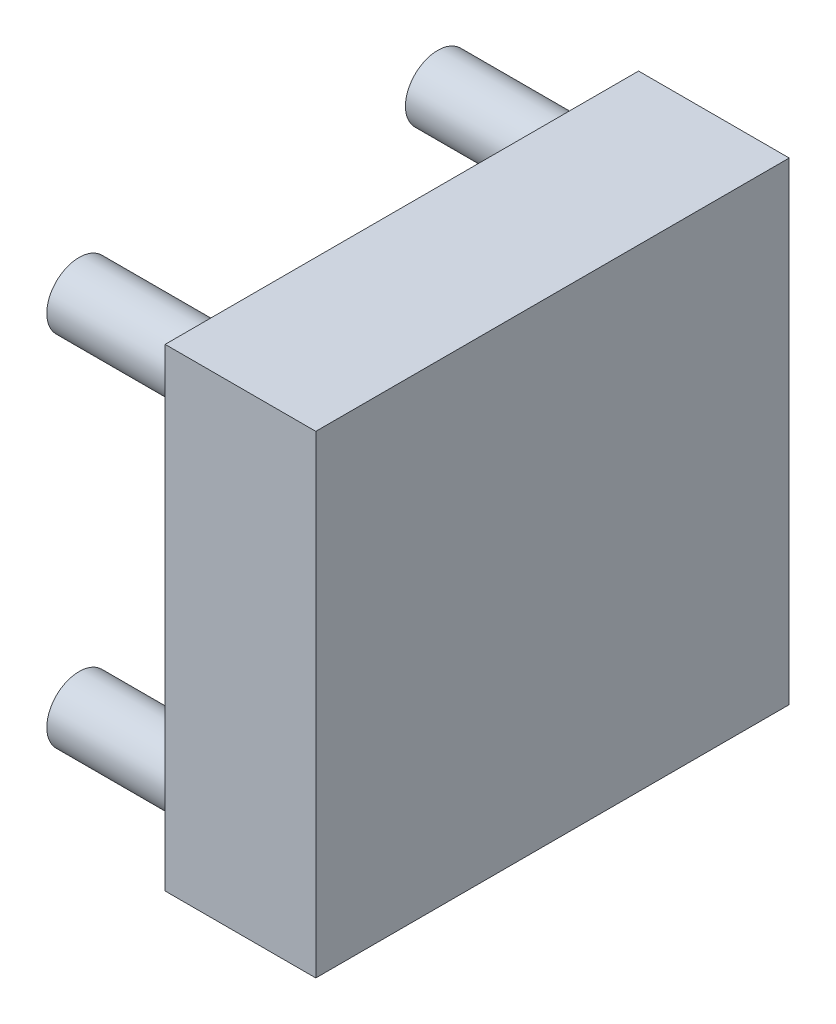
from build123d import *

# Parameters (mm, degrees)
SKETCH1_W           = 33
SKETCH1_H           = 33
BOSS_EXTRUDE1_DEPTH = 10.5
SKETCH2_R           = 2.25
SKETCH2_R_2         = 1.5
BOSS_EXTRUDE2_DEPTH = 10


with BuildPart() as part:
    # Sketch1 → Boss-Extrude1 (new body)
    with BuildSketch(Plane(origin=(0, 0, 0), x_dir=(0, 0, -1), z_dir=(1, 0, 0))):
        Rectangle(SKETCH1_W, SKETCH1_H)
    extrude(amount=BOSS_EXTRUDE1_DEPTH)

    # Sketch2 → Boss-Extrude2 (add)
    # profile 1 of 4: a face of its own
    with BuildSketch(Plane.ZY):
        with Locations((-12.5, 12.5)):
            Circle(SKETCH2_R)
        with Locations((-12.5, 12.5)):
            Circle(SKETCH2_R_2, mode=Mode.SUBTRACT)
    # profile 2 of 4: a face of its own
    with BuildSketch(Plane.ZY):
        with Locations((-12.5, -12.5)):
            Circle(SKETCH2_R)
        with Locations((-12.5, -12.5)):
            Circle(SKETCH2_R_2, mode=Mode.SUBTRACT)
    # profile 3 of 4: a face of its own
    with BuildSketch(Plane.ZY):
        with Locations((12.5, -12.5)):
            Circle(SKETCH2_R)
        with Locations((12.5, -12.5)):
            Circle(SKETCH2_R_2, mode=Mode.SUBTRACT)
    # profile 4 of 4: a face of its own
    with BuildSketch(Plane.ZY):
        with Locations((12.5, 12.5)):
            Circle(SKETCH2_R)
        with Locations((12.5, 12.5)):
            Circle(SKETCH2_R_2, mode=Mode.SUBTRACT)
    extrude(amount=BOSS_EXTRUDE2_DEPTH)


solid = part.part
